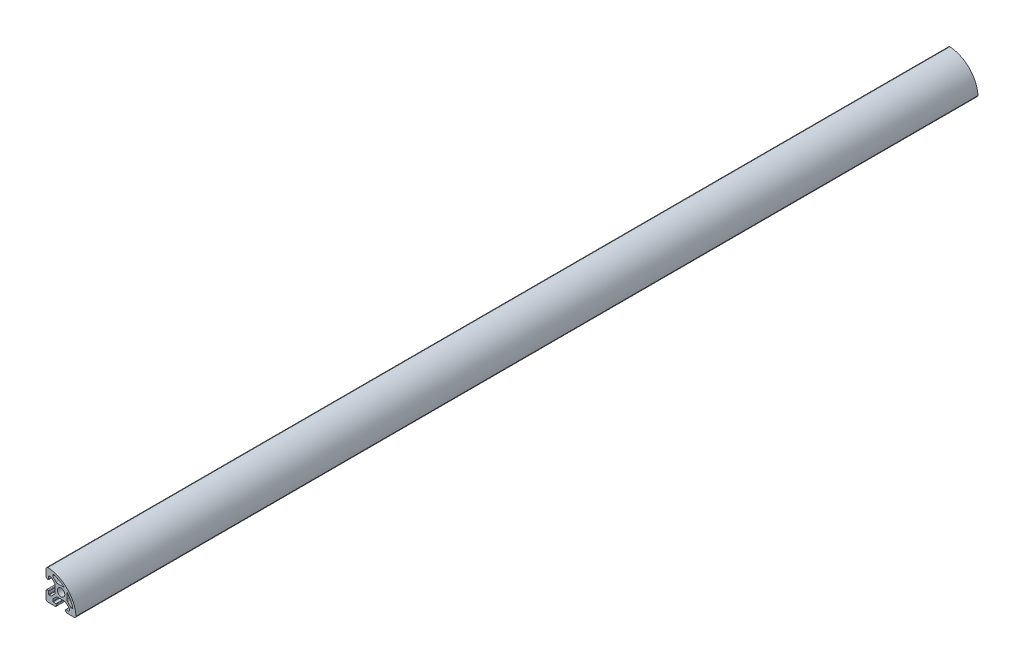
from build123d import *

# Parameters (mm, degrees)
SKETCH_1_R      = 2.5
EXTRUDE_1_DEPTH = 600


with BuildPart() as part:
    # 草图1 → 凸台-拉伸1 (new body)
    with BuildSketch(Plane.XY):
        with BuildLine():
            ThreePointArc((-8.944458369, 9.930115847), (-9.792033903, 9.405190523), (-10.123344197, 8.464890373))
            Line((-10.123344197, 8.464890373), (-10.123344197, 3.564890373))
            Line((-10.123344197, 3.564890373), (-9.823344197, 3.564890373))
            ThreePointArc((-9.823344197, 3.564890373), (-9.681922841, 3.50631173), (-9.623344197, 3.364890373))
            Line((-9.623344197, 3.364890373), (-9.623344197, 3.064890373))
            Line((-9.623344197, 3.064890373), (-8.623344197, 3.064890373))
            ThreePointArc((-8.623344197, 3.064890373), (-8.411212162, 3.152758339), (-8.323344197, 3.364890373))
            Line((-8.323344197, 3.364890373), (-8.323344197, 5.164890373))
            ThreePointArc((-8.323344197, 5.164890373), (-8.235476231, 5.377022408), (-8.023344197, 5.464890373))
            Line((-8.023344197, 5.464890373), (-6.683344197, 5.464890373))
            Line((-6.683344197, 5.464890373), (-4.462684025, 3.244230202))
            ThreePointArc((-4.462684025, 3.244230202), (-4.137524898, 2.757595178), (-4.023344197, 2.18357003))
            Line((-4.023344197, 2.18357003), (-4.023344197, -2.253789283))
            ThreePointArc((-4.023344197, -2.253789283), (-4.137524898, -2.827814432), (-4.462684025, -3.314449455))
            Line((-4.462684025, -3.314449455), (-6.683344197, -5.535109627))
            Line((-6.683344197, -5.535109627), (-8.023344197, -5.535109627))
            ThreePointArc((-8.023344197, -5.535109627), (-8.235476231, -5.447241661), (-8.323344197, -5.235109627))
            Line((-8.323344197, -5.235109627), (-8.323344197, -3.435109627))
            ThreePointArc((-8.323344197, -3.435109627), (-8.411212162, -3.222977592), (-8.623344197, -3.135109627))
            Line((-8.623344197, -3.135109627), (-9.623344197, -3.135109627))
            Line((-9.623344197, -3.135109627), (-9.623344197, -3.435109627))
            ThreePointArc((-9.623344197, -3.435109627), (-9.681922841, -3.576530983), (-9.823344197, -3.635109627))
            Line((-9.823344197, -3.635109627), (-10.123344197, -3.635109627))
            Line((-10.123344197, -3.635109627), (-10.123344197, -8.535109627))
            ThreePointArc((-10.123344197, -8.535109627), (-9.684004369, -9.595769798), (-8.623344197, -10.035109627))
            Line((-8.623344197, -10.035109627), (-3.723344197, -10.035109627))
            Line((-3.723344197, -10.035109627), (-3.723344197, -9.735109627))
            ThreePointArc((-3.723344197, -9.735109627), (-3.664765553, -9.59368827), (-3.523344197, -9.535109627))
            Line((-3.523344197, -9.535109627), (-3.223344197, -9.535109627))
            Line((-3.223344197, -9.535109627), (-3.223344197, -8.535109627))
            ThreePointArc((-3.223344197, -8.535109627), (-3.311212162, -8.322977592), (-3.523344197, -8.235109627))
            Line((-3.523344197, -8.235109627), (-5.323344197, -8.235109627))
            ThreePointArc((-5.323344197, -8.235109627), (-5.535476231, -8.147241661), (-5.623344197, -7.935109627))
            Line((-5.623344197, -7.935109627), (-5.623344197, -6.595109627))
            Line((-5.623344197, -6.595109627), (-3.402684025, -4.374449455))
            ThreePointArc((-3.402684025, -4.374449455), (-2.916049002, -4.049290328), (-2.342023853, -3.935109627))
            Line((-2.342023853, -3.935109627), (2.09533546, -3.935109627))
            ThreePointArc((2.09533546, -3.935109627), (2.669360608, -4.049290328), (3.155995631, -4.374449455))
            Line((3.155995631, -4.374449455), (5.376655803, -6.595109627))
            Line((5.376655803, -6.595109627), (5.376655803, -7.935109627))
            ThreePointArc((5.376655803, -7.935109627), (5.288787838, -8.147241661), (5.076655803, -8.235109627))
            Line((5.076655803, -8.235109627), (3.276655803, -8.235109627))
            ThreePointArc((3.276655803, -8.235109627), (3.064523769, -8.322977592), (2.976655803, -8.535109627))
            Line((2.976655803, -8.535109627), (2.976655803, -9.535109627))
            Line((2.976655803, -9.535109627), (3.276655803, -9.535109627))
            ThreePointArc((3.276655803, -9.535109627), (3.418077159, -9.59368827), (3.476655803, -9.735109627))
            Line((3.476655803, -9.735109627), (3.476655803, -10.035109627))
            Line((3.476655803, -10.035109627), (8.376655803, -10.035109627))
            ThreePointArc((8.376655803, -10.035109627), (9.316955952, -9.703799333), (9.841881277, -8.856223799))
            ThreePointArc((9.841881277, -8.856223799), (4.018791427, 4.107025997), (-8.944458369, 9.930115847))
        make_face()
        with BuildLine():
            ThreePointArc((7.820216628, -5.531930203), (7.798494154, -5.534313715), (7.776655803, -5.535109627))
            Line((7.776655803, -5.535109627), (6.436655803, -5.535109627))
            Line((6.436655803, -5.535109627), (4.215995631, -3.314449455))
            ThreePointArc((4.215995631, -3.314449455), (3.890836504, -2.827814432), (3.776655803, -2.253789283))
            Line((3.776655803, -2.253789283), (3.776655803, 2.173084343))
            ThreePointArc((3.776655803, 2.173084343), (6.257892136, -1.4383023), (7.820216628, -5.531930203))
        make_face(mode=Mode.SUBTRACT)
        with BuildLine():
            ThreePointArc((-5.620164773, 7.908451198), (-1.52653687, 6.346126706), (2.084849773, 3.864890373))
            Line((2.084849773, 3.864890373), (-2.342023853, 3.864890373))
            ThreePointArc((-2.342023853, 3.864890373), (-2.916049002, 3.979071075), (-3.402684025, 4.304230202))
            Line((-3.402684025, 4.304230202), (-5.623344197, 6.524890373))
            Line((-5.623344197, 6.524890373), (-5.623344197, 7.864890373))
            ThreePointArc((-5.623344197, 7.864890373), (-5.622548285, 7.886728724), (-5.620164773, 7.908451198))
        make_face(mode=Mode.SUBTRACT)
        with Locations((-0.123344197, -0.035109627)):
            Circle(SKETCH_1_R, mode=Mode.SUBTRACT)
    extrude(amount=EXTRUDE_1_DEPTH)


solid = part.part
